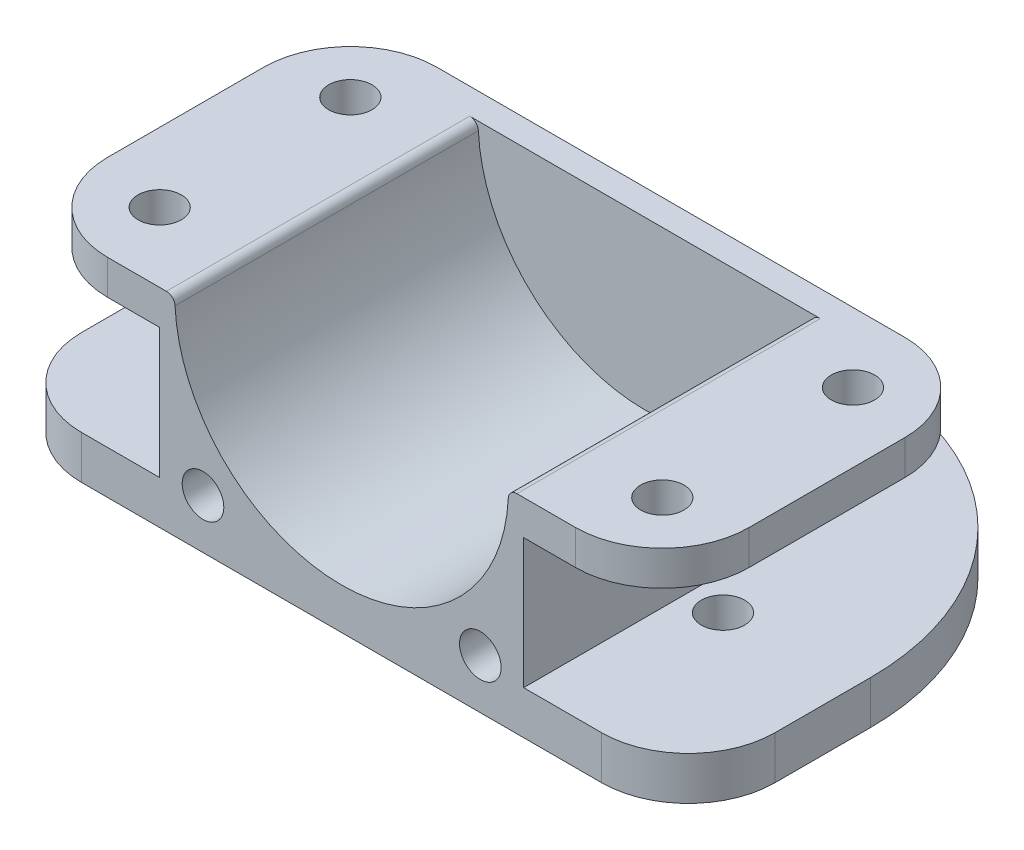
from build123d import *

# Parameters (mm, degrees)
SKETCH1_W            = 42
SKETCH1_H            = 48
SKETCH1_R            = 19.25
SKETCH1_R_2          = 2.4
BOSS_EXTRUDE1_DEPTH  = 35
SKETCH4_W            = 19
SKETCH4_H            = 5
BOSS_EXTRUDE3_DEPTH  = 35
CUT_EXTRUDE1_REACH   = 70.367
SKETCH5_R            = 2.5
BOSS_EXTRUDE4_DEPTH  = 3
CUT_EXTRUDE2_REACH   = 62.166
SKETCH7_W            = 42
SKETCH7_H            = 24
FILLET1_R            = 1
SKETCH8_W            = 80
SKETCH8_H            = 13
BOSS_EXTRUDE5_DEPTH  = 5
CUT_EXTRUDE4_REACH   = 69.543
SKETCH10_R           = 2.5
FILLET5_R            = 30
FILLET6_R            = 10
SKETCH12_W           = 38
SKETCH12_H           = 4
BOSS_EXTRUDE6_DEPTH  = 16
CUT_EXTRUDE5_REACH   = 71.116
SKETCH13_R           = 2.5
FILLET7_R            = 10
FILLET7_OF_MIRROR1_R = 10


with BuildPart() as part:
    # Sketch1 → Boss-Extrude1 (new body)
    with BuildSketch(Plane.XY):
        Rectangle(SKETCH1_W, SKETCH1_H)
        Circle(SKETCH1_R, mode=Mode.SUBTRACT)
        with Locations((-16, 18.285714286)):
            Circle(SKETCH1_R_2, mode=Mode.SUBTRACT)
        with Locations((16, 18.285714286)):
            Circle(SKETCH1_R_2, mode=Mode.SUBTRACT)
        with Locations((16, -18.285714286)):
            Circle(SKETCH1_R_2, mode=Mode.SUBTRACT)
        with Locations((-16, -18.285714286)):
            Circle(SKETCH1_R_2, mode=Mode.SUBTRACT)
    extrude(amount=-BOSS_EXTRUDE1_DEPTH)

    # Sketch4 → Boss-Extrude3 (add)
    with BuildSketch(Plane.XY):
        with Locations((-30.5, -21.5)):
            Rectangle(SKETCH4_W, SKETCH4_H)
        with Locations((30.5, -21.5)):
            Rectangle(SKETCH4_W, SKETCH4_H)
    extrude(amount=-BOSS_EXTRUDE3_DEPTH)

    # Sketch5 → Cut-Extrude1 (cut, up to next)
    with BuildSketch(Plane(origin=(0, -19, 0), x_dir=(1, 0, 0), z_dir=(0, 1, 0)), mode=Mode.PRIVATE) as cut_extrude1_sk1:
        with Locations(Location((-25, 19, 0), (0, 0, 270))):
            Circle(SKETCH5_R)
    cut_extrude1_tool1 = extrude(cut_extrude1_sk1.sketch, amount=-CUT_EXTRUDE1_REACH, mode=Mode.PRIVATE) & part.part
    # Sketch5 → Cut-Extrude1 (cut, up to next)
    with BuildSketch(Plane(origin=(0, -19, 0), x_dir=(1, 0, 0), z_dir=(0, 1, 0)), mode=Mode.PRIVATE) as cut_extrude1_sk2:
        with Locations(Location((25, 19, 0), (0, 0, 270))):
            Circle(SKETCH5_R)
    cut_extrude1_tool2 = extrude(cut_extrude1_sk2.sketch, amount=-CUT_EXTRUDE1_REACH, mode=Mode.PRIVATE) & part.part
    add(cut_extrude1_tool1.solids().sort_by_distance((-25, -19, -19))[0], mode=Mode.SUBTRACT)
    add(cut_extrude1_tool2.solids().sort_by_distance((25, -19, -19))[0], mode=Mode.SUBTRACT)

    # Sketch6 → Boss-Extrude4 (add)
    with BuildSketch(Plane(origin=(0, 0, -35), x_dir=(-1, 0, 0), z_dir=(0, 0, -1))):
        Polygon((-21, 24), (-21, -19), (-40, -19), (-40, -24), (40, -24), (40, -19), (21, -19), (21, 24), align=None)
    extrude(amount=BOSS_EXTRUDE4_DEPTH)

    # Sketch7 → Cut-Extrude2 (cut, up to next)
    with BuildSketch(Plane.XY, mode=Mode.PRIVATE) as cut_extrude2_sk1:
        with Locations((0, 12)):
            Rectangle(SKETCH7_W, SKETCH7_H)
    cut_extrude2_tool1 = extrude(cut_extrude2_sk1.sketch, amount=-CUT_EXTRUDE2_REACH, mode=Mode.PRIVATE) & part.part
    add(cut_extrude2_tool1.solids().sort_by_distance((0, 12, 0))[0], mode=Mode.SUBTRACT)

    # Fillet1
    fillet1_edges = [part.edges().sort_by_distance(p)[0] for p in [
        (19.25, 0, -17.5),
        (-19.25, 0, -17.5),
    ]]
    fillet(fillet1_edges, radius=FILLET1_R)

    # Sketch8 → Boss-Extrude5 (add)
    with BuildSketch(Plane.XZ.offset(24)):
        with Locations((0, -44.5)):
            Rectangle(SKETCH8_W, SKETCH8_H)
    extrude(amount=-BOSS_EXTRUDE5_DEPTH)

    # Sketch10 → Cut-Extrude4 (cut, up to next)
    with BuildSketch(Plane(origin=(0, -19, 0), x_dir=(1, 0, 0), z_dir=(0, 1, 0)), mode=Mode.PRIVATE) as cut_extrude4_sk1:
        with Locations(Location((-15, 43, 0), (0, 0, 180))):
            Circle(SKETCH10_R)
    cut_extrude4_tool1 = extrude(cut_extrude4_sk1.sketch, amount=-CUT_EXTRUDE4_REACH, mode=Mode.PRIVATE) & part.part
    # Sketch10 → Cut-Extrude4 (cut, up to next)
    with BuildSketch(Plane(origin=(0, -19, 0), x_dir=(1, 0, 0), z_dir=(0, 1, 0)), mode=Mode.PRIVATE) as cut_extrude4_sk2:
        with Locations(Location((15, 43, 0), (0, 0, 180))):
            Circle(SKETCH10_R)
    cut_extrude4_tool2 = extrude(cut_extrude4_sk2.sketch, amount=-CUT_EXTRUDE4_REACH, mode=Mode.PRIVATE) & part.part
    add(cut_extrude4_tool1.solids().sort_by_distance((-15, -19, -43))[0], mode=Mode.SUBTRACT)
    add(cut_extrude4_tool2.solids().sort_by_distance((15, -19, -43))[0], mode=Mode.SUBTRACT)

    # Fillet5
    fillet5_edges = [part.edges().sort_by_distance(p)[0] for p in [
        (-40, -21.5, -51),
        (40, -21.5, -51),
    ]]
    fillet(fillet5_edges, radius=FILLET5_R)

    # Fillet6
    fillet6_edges = [part.edges().sort_by_distance(p)[0] for p in [
        (-40, -21.5, 0),
        (40, -21.5, 0),
    ]]
    fillet(fillet6_edges, radius=FILLET6_R)

    # Sketch12 → Boss-Extrude6 (add)
    with BuildSketch(Plane.ZY.offset(21)):
        with Locations((-19, -2)):
            Rectangle(SKETCH12_W, SKETCH12_H)
    boss_extrude6 = extrude(amount=BOSS_EXTRUDE6_DEPTH)

    # Sketch13 → Cut-Extrude5 (cut, up to next)
    with BuildSketch(Plane(origin=(0, 0, 0), x_dir=(1, 0, 0), z_dir=(0, 1, 0)), mode=Mode.PRIVATE) as cut_extrude5_sk1:
        with Locations(Location((-29, 8, 0), (0, 0, 270))):
            Circle(SKETCH13_R)
    cut_extrude5_tool1 = extrude(cut_extrude5_sk1.sketch, amount=-CUT_EXTRUDE5_REACH, mode=Mode.PRIVATE) & part.part
    # Sketch13 → Cut-Extrude5 (cut, up to next)
    with BuildSketch(Plane(origin=(0, 0, 0), x_dir=(1, 0, 0), z_dir=(0, 1, 0)), mode=Mode.PRIVATE) as cut_extrude5_sk2:
        with Locations(Location((-29, 30, 0), (0, 0, 270))):
            Circle(SKETCH13_R)
    cut_extrude5_tool2 = extrude(cut_extrude5_sk2.sketch, amount=-CUT_EXTRUDE5_REACH, mode=Mode.PRIVATE) & part.part
    cut_extrude5_1 = cut_extrude5_tool1.solids().sort_by_distance((-29, 0, -8))[0]
    add(cut_extrude5_1, mode=Mode.SUBTRACT)
    cut_extrude5_2 = cut_extrude5_tool2.solids().sort_by_distance((-29, 0, -30))[0]
    add(cut_extrude5_2, mode=Mode.SUBTRACT)
    cut_extrude5 = cut_extrude5_1 + cut_extrude5_2  # Cut-Extrude5 as one shape, for the pattern or mirror that repeats it

    # Fillet7
    fillet7_edges = [part.edges().sort_by_distance(p)[0] for p in [
        (-37, -2, 0),
        (-37, -2, -38),
    ]]
    fillet(fillet7_edges, radius=FILLET7_R)

    # Mirror1: Boss-Extrude6, Cut-Extrude5 across plane
    add(boss_extrude6.mirror(Plane(origin=(0, 0, 0), x_dir=(0, 0, 1), z_dir=(1, 0, 0))))
    add(cut_extrude5.mirror(Plane(origin=(0, 0, 0), x_dir=(0, 0, 1), z_dir=(1, 0, 0))), mode=Mode.SUBTRACT)

    # Fillet7 of Mirror1
    fillet7_of_mirror1_edges = [part.edges().sort_by_distance(p)[0] for p in [
        (37, -2, 0),
        (37, -2, -38),
    ]]
    fillet(fillet7_of_mirror1_edges, radius=FILLET7_OF_MIRROR1_R)


solid = part.part
